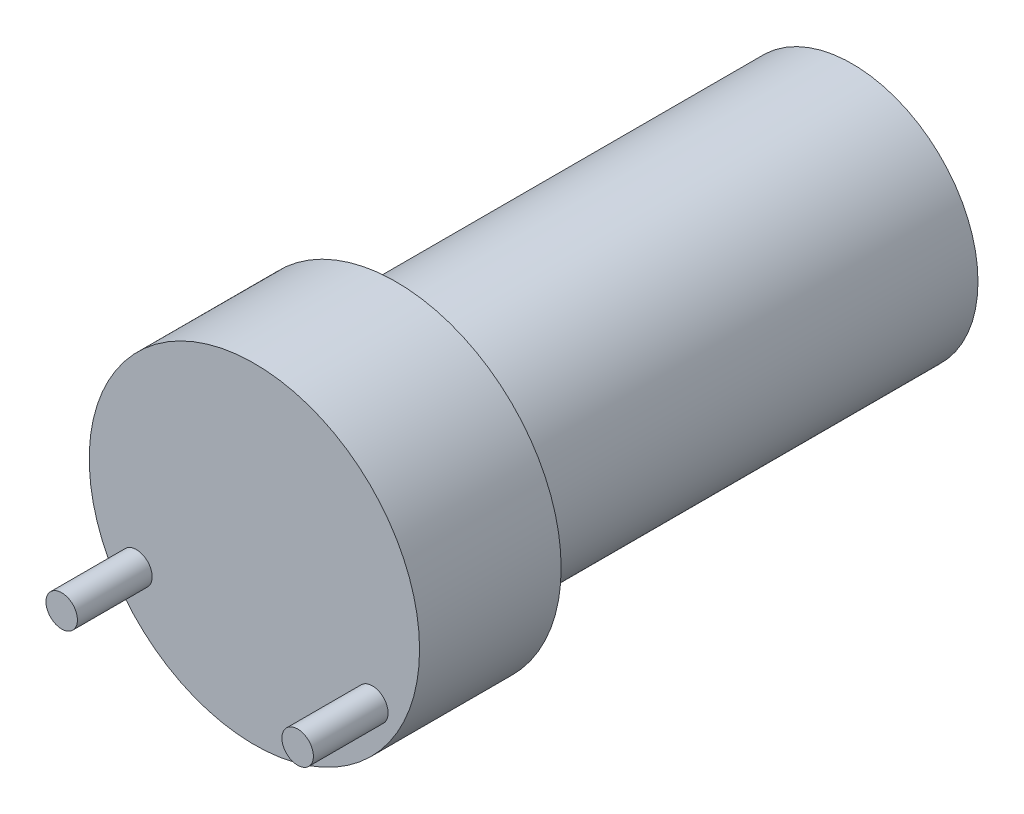
from build123d import *

# Parameters (mm, degrees)
ESQUISSE1_R        = 21
BOSS_EXTRU_1_DEPTH = 18
ESQUISSE2_R        = 16
BOSS_EXTRU_2_DEPTH = 58
ESQUISSE7_R        = 2
BOSS_EXTRU_3_DEPTH = 9.5


with BuildPart() as part:
    # Esquisse1 → Boss.-Extru.1 (new body)
    with BuildSketch(Plane.XY):
        Circle(ESQUISSE1_R)
    extrude(amount=BOSS_EXTRU_1_DEPTH)

    # Esquisse2 → Boss.-Extru.2 (add)
    with BuildSketch(Plane(origin=(0, 0, 0), x_dir=(-1, 0, 0), z_dir=(0, 0, -1))):
        with Locations(Location((0, 0, 0), (0, 0, 180))):
            Circle(ESQUISSE2_R)
    extrude(amount=BOSS_EXTRU_2_DEPTH)

    # Esquisse7 → Boss.-Extru.3 (add)
    with BuildSketch(Plane.XY.offset(18)):
        with Locations((-15, -9)):
            Circle(ESQUISSE7_R)
        with Locations((15, -9)):
            Circle(ESQUISSE7_R)
    extrude(amount=BOSS_EXTRU_3_DEPTH)


solid = part.part
